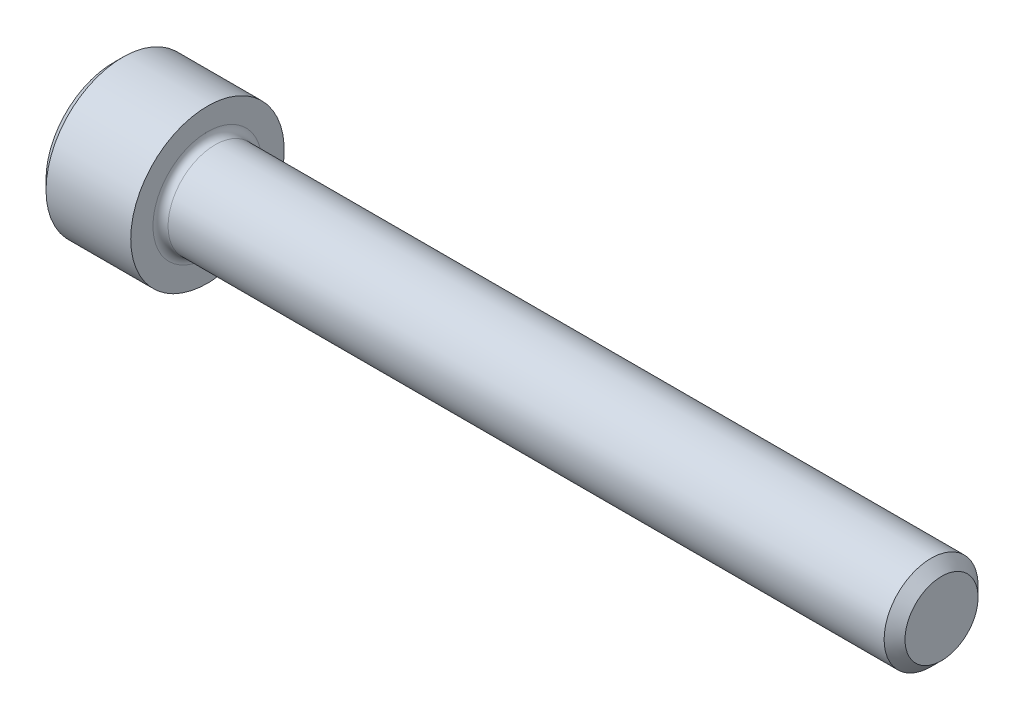
from build123d import *

# Parameters (mm, degrees)
FILLET1_R   = 0.2286
HEX_2_DEPTH = 1.2954


with BuildPart() as part:
    # BodySke → Base-Revolve (revolve)
    with BuildSketch(Plane.XY, mode=Mode.PRIVATE) as base_revolve_sk:
        Polygon((0, 0), (0, 2.0447), (0.2794, 2.3241), (2.8448, 2.3241), (2.8448, 1.4224), (24.75357, 1.4224), (25.0698, 1.10617), (25.0698, 0), align=None)
    revolve(base_revolve_sk.sketch.rotate(Axis((-31.75, 0, 0), (1, 0, 0)), 90), axis=Axis((-31.75, 0, 0), (1, 0, 0)))

    # Fillet1
    fillet1_edges = [part.edges().sort_by_distance(p)[0] for p in [
        (2.8448, 0, -1.4224),
    ]]
    fillet(fillet1_edges, radius=FILLET1_R)

    # Sketch2 → Hex-PreBroach (revolve, cut)
    with BuildSketch(Plane.XY, mode=Mode.PRIVATE) as hex_prebroach_sk:
        Polygon((0, 1.1938), (1.2954, 1.1938), (1.984640751, 0), (0, 0), align=None)
    revolve(hex_prebroach_sk.sketch.rotate(Axis((0, 0, 0), (1, 0, 0)), 90), axis=Axis((0, 0, 0), (1, 0, 0)), mode=Mode.SUBTRACT)

    # Sketch3 → Hex 2 (cut)
    with BuildSketch(Plane(origin=(0, 0, 0), x_dir=(0, 0.500000000000001, 0.866025403784438), z_dir=(-1, 0, 0))):
        Polygon((0.689240751, 1.1938), (-0.689240751, 1.1938), (-1.378481503, 0), (-0.689240751, -1.1938), (0.689240751, -1.1938), (1.378481503, 0), align=None)
    extrude(amount=-HEX_2_DEPTH, mode=Mode.SUBTRACT)


solid = part.part
